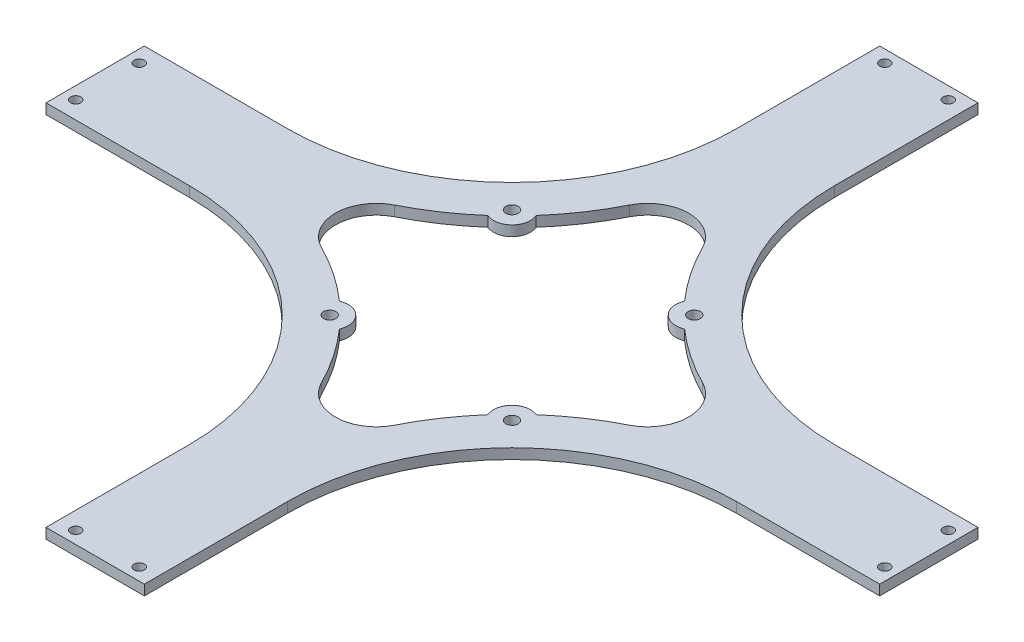
from build123d import *

# Parameters (mm, degrees)
SKETCH1_R           = 1.25
BOSS_EXTRUDE1_DEPTH = 2.5
BOSS_EXTRUDE2_START = -2.5
BOSS_EXTRUDE2_DEPTH = 2.5
SKETCH3_R           = 1.5
CUT_EXTRUDE1_DEPTH  = 2.5


with BuildPart() as part:
    # Sketch1 → Boss-Extrude1 (new body)
    with BuildSketch(Plane(origin=(0, 0, 0), x_dir=(1, 0, 0), z_dir=(0, 1, 0))):
        with BuildLine():
            Line((-12, 101.75), (-12, 66.75))
            ThreePointArc((-12, 66.75), (-28.03590373, 28.03590373), (-66.75, 12))
            Line((-66.75, 12), (-101.75, 12))
            Line((-101.75, 12), (-101.75, -12))
            Line((-101.75, -12), (-66.75, -12))
            ThreePointArc((-66.75, -12), (-28.03590373, -28.03590373), (-12, -66.75))
            Line((-12, -66.75), (-12, -101.75))
            Line((-12, -101.75), (12, -101.75))
            Line((12, -101.75), (12, -66.75))
            ThreePointArc((12, -66.75), (28.03590373, -28.03590373), (66.75, -12))
            Line((66.75, -12), (101.75, -12))
            Line((101.75, -12), (101.75, 12))
            Line((101.75, 12), (66.75, 12))
            ThreePointArc((66.75, 12), (28.03590373, 28.03590373), (12, 66.75))
            Line((12, 66.75), (12, 101.75))
            Line((12, 101.75), (-12, 101.75))
        make_face()
        with Locations(Location((-7.75, 98.75, 0), (0, 0, 270))):
            Circle(SKETCH1_R, mode=Mode.SUBTRACT)
        with Locations(Location((7.75, 98.75, 0), (0, 0, 270))):
            Circle(SKETCH1_R, mode=Mode.SUBTRACT)
        with Locations(Location((7.75, -98.75, 0), (0, 0, 270))):
            Circle(SKETCH1_R, mode=Mode.SUBTRACT)
        with Locations(Location((-7.75, -98.75, 0), (0, 0, 270))):
            Circle(SKETCH1_R, mode=Mode.SUBTRACT)
        with Locations(Location((98.75, 7.75, 0), (0, 0, 270))):
            Circle(SKETCH1_R, mode=Mode.SUBTRACT)
        with Locations(Location((98.75, -7.75, 0), (0, 0, 270))):
            Circle(SKETCH1_R, mode=Mode.SUBTRACT)
        with Locations(Location((-98.75, -7.75, 0), (0, 0, 270))):
            Circle(SKETCH1_R, mode=Mode.SUBTRACT)
        with Locations(Location((-98.75, 7.75, 0), (0, 0, 270))):
            Circle(SKETCH1_R, mode=Mode.SUBTRACT)
        with BuildLine():
            ThreePointArc((-8.929765886, -37.605823446), (-20.964835918, -20.964835918), (-37.605823446, -8.929765886))
            ThreePointArc((-37.605823446, -8.929765886), (-43.104792317, 0), (-37.605823446, 8.929765886))
            ThreePointArc((-37.605823446, 8.929765886), (-20.964835918, 20.964835918), (-8.929765886, 37.605823446))
            ThreePointArc((-8.929765886, 37.605823446), (0, 43.104792317), (8.929765886, 37.605823446))
            ThreePointArc((8.929765886, 37.605823446), (20.964835918, 20.964835918), (37.605823446, 8.929765886))
            ThreePointArc((37.605823446, 8.929765886), (43.104792317, 0), (37.605823446, -8.929765886))
            ThreePointArc((37.605823446, -8.929765886), (20.964835918, -20.964835918), (8.929765886, -37.605823446))
            ThreePointArc((8.929765886, -37.605823446), (0, -43.104792317), (-8.929765886, -37.605823446))
        make_face(mode=Mode.SUBTRACT)
    extrude(amount=BOSS_EXTRUDE1_DEPTH)

    # Sketch2 → Boss-Extrude2 (add)
    with BuildSketch(Plane(origin=(0, 2.5, 0), x_dir=(1, 0, 0), z_dir=(0, 1, 0)).offset(BOSS_EXTRUDE2_START)):
        with BuildLine():
            ThreePointArc((-18.108940598, -24.011143671), (-17.840648159, -23.148674772), (-17.75, -22.25))
            ThreePointArc((-17.75, -22.25), (-19.767576438, -18.496658387), (-24.011143671, -18.108940598))
            ThreePointArc((-24.011143671, -18.108940598), (-20.964835918, -20.964835918), (-18.108940598, -24.011143671))
        make_face()
        with BuildLine():
            ThreePointArc((-24.011143671, 18.108940598), (-19.767576438, 18.496658387), (-17.75, 22.25))
            ThreePointArc((-17.75, 22.25), (-17.840648159, 23.148674772), (-18.108940598, 24.011143671))
            ThreePointArc((-18.108940598, 24.011143671), (-20.964835918, 20.964835918), (-24.011143671, 18.108940598))
        make_face()
        with BuildLine():
            ThreePointArc((24.011143671, 18.108940598), (20.964835918, 20.964835918), (18.108940598, 24.011143671))
            ThreePointArc((18.108940598, 24.011143671), (19.068019485, 19.068019485), (24.011143671, 18.108940598))
        make_face()
        with BuildLine():
            ThreePointArc((18.108940598, -24.011143671), (20.964835918, -20.964835918), (24.011143671, -18.108940598))
            ThreePointArc((24.011143671, -18.108940598), (19.068019485, -19.068019485), (18.108940598, -24.011143671))
        make_face()
    extrude(amount=BOSS_EXTRUDE2_DEPTH)

    # Sketch3 → Cut-Extrude1 (cut)
    with BuildSketch(Plane(origin=(0, 2.5, 0), x_dir=(1, 0, 0), z_dir=(0, 1, 0))):
        with Locations(Location((-22.25, 22.25, 0), (0, 0, 270))):
            Circle(SKETCH3_R)
        with Locations(Location((22.25, 22.25, 0), (0, 0, 270))):
            Circle(SKETCH3_R)
        with Locations(Location((22.25, -22.25, 0), (0, 0, 270))):
            Circle(SKETCH3_R)
        with Locations(Location((-22.25, -22.25, 0), (0, 0, 270))):
            Circle(SKETCH3_R)
    extrude(amount=-CUT_EXTRUDE1_DEPTH, mode=Mode.SUBTRACT)


solid = part.part
